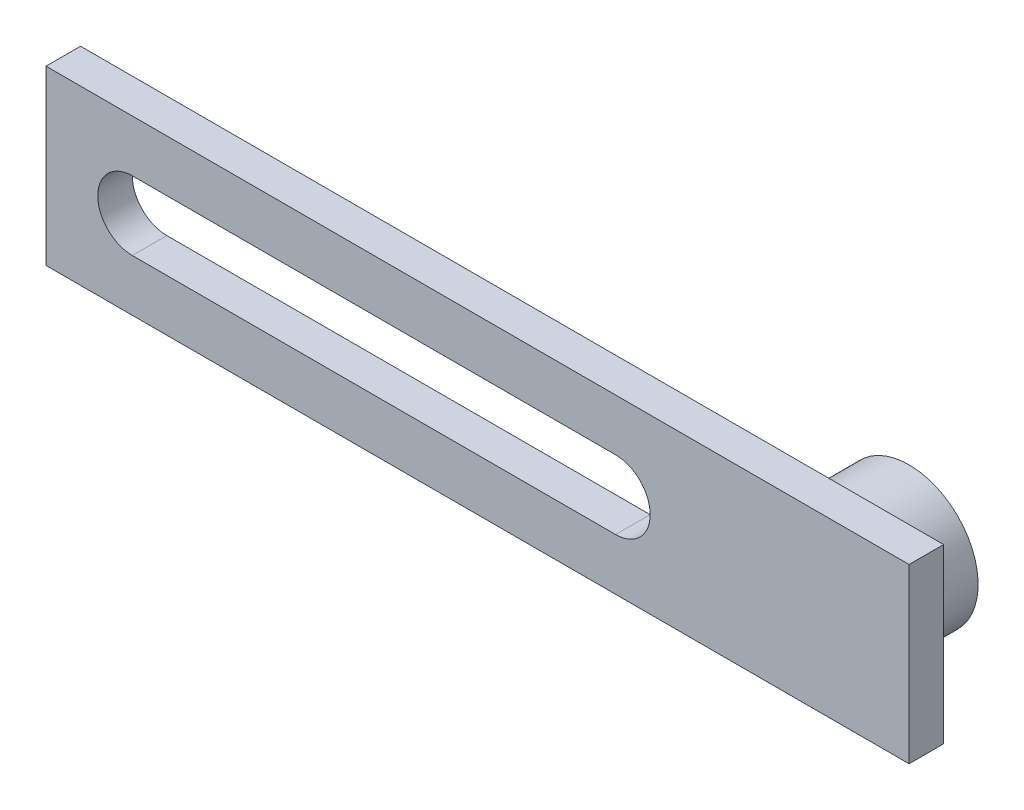
from build123d import *

# Parameters (mm, degrees)
SKETCH1_W           = 125
SKETCH1_H           = 25
BOSS_EXTRUDE1_DEPTH = 5
SKETCH2_R           = 10
BOSS_EXTRUDE2_DEPTH = 5
SKETCH3_R           = 10
SKETCH3_R_2         = 5
BOSS_EXTRUDE3_DEPTH = 5


with BuildPart() as part:
    # Sketch1 → Boss-Extrude1 (new body)
    with BuildSketch(Plane.XY):
        with Locations((-62.5, -12.5)):
            Rectangle(SKETCH1_W, SKETCH1_H)
        with BuildLine():
            Line((-112.5, -7.5), (-42.5, -7.5))
            ThreePointArc((-42.5, -7.5), (-37.5, -12.5), (-42.5, -17.5))
            Line((-42.5, -17.5), (-112.5, -17.5))
            ThreePointArc((-112.5, -17.5), (-117.5, -12.5), (-112.5, -7.5))
        make_face(mode=Mode.SUBTRACT)
    extrude(amount=BOSS_EXTRUDE1_DEPTH)

    # Sketch2 → Boss-Extrude2 (add)
    with BuildSketch(Plane(origin=(0, 0, 0), x_dir=(-1, 0, 0), z_dir=(0, 0, -1))):
        with Locations((15, -12.5)):
            Circle(SKETCH2_R)
    extrude(amount=BOSS_EXTRUDE2_DEPTH)

    # Sketch3 → Boss-Extrude3 (add)
    with BuildSketch(Plane(origin=(0, 0, -5), x_dir=(-1, 0, 0), z_dir=(0, 0, -1))):
        with Locations((15, -12.5)):
            Circle(SKETCH3_R)
        with Locations((15, -12.5)):
            Circle(SKETCH3_R_2, mode=Mode.SUBTRACT)
    extrude(amount=BOSS_EXTRUDE3_DEPTH)


solid = part.part
